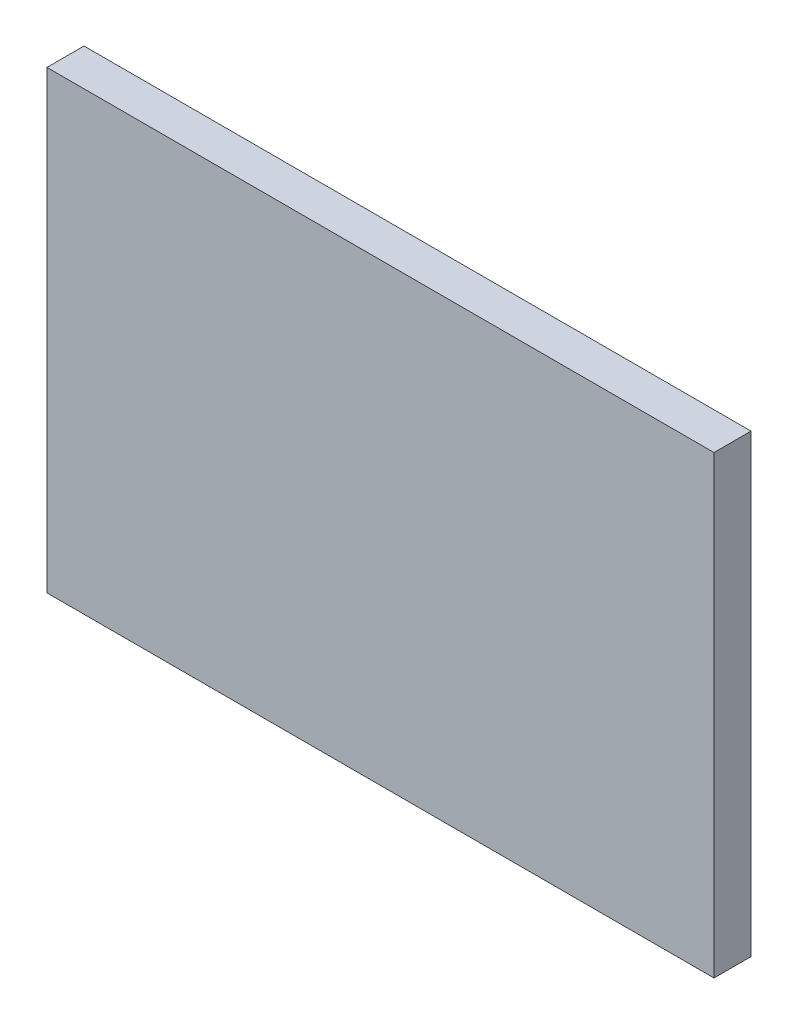
from build123d import *

# Parameters (mm, degrees)
SKETCH1_W           = 114.3
SKETCH1_H           = 77.978
BOSS_EXTRUDE1_DEPTH = 6.35


with BuildPart() as part:
    # Sketch1 → Boss-Extrude1 (new body)
    with BuildSketch(Plane.XY):
        Rectangle(SKETCH1_W, SKETCH1_H)
    extrude(amount=BOSS_EXTRUDE1_DEPTH)


solid = part.part
